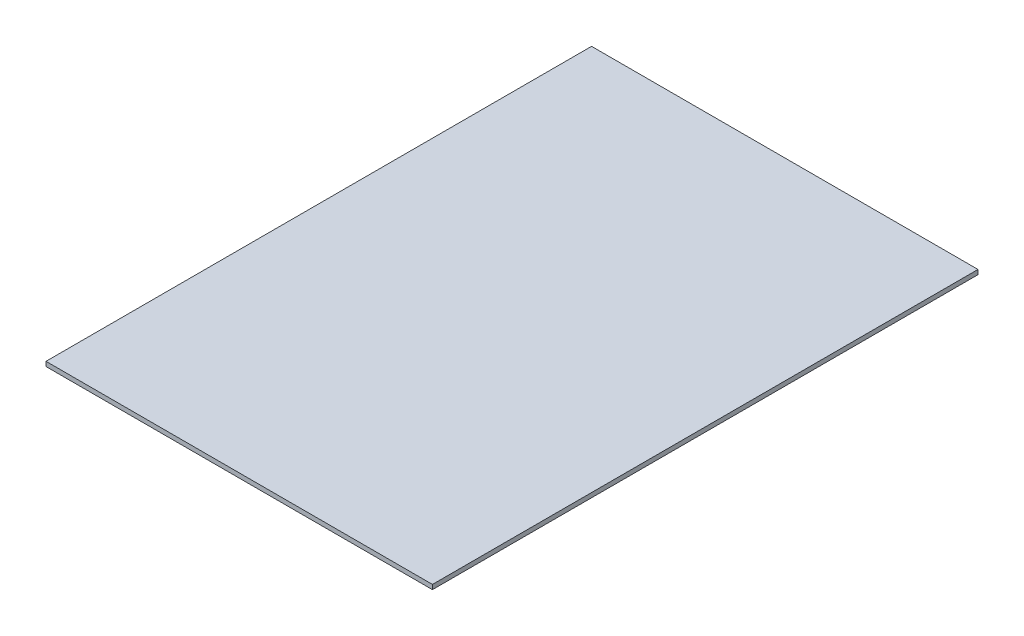
from build123d import *

# Parameters (mm, degrees)
SKETCH_1_W      = 85
SKETCH_1_H      = 120
EXTRUDE_1_DEPTH = 1


with BuildPart() as part:
    # Эскиз1 → Бобышка-Вытянуть1 (new body)
    with BuildSketch(Plane(origin=(0, 0, 0), x_dir=(1, 0, 0), z_dir=(0, 1, 0))):
        Rectangle(SKETCH_1_W, SKETCH_1_H)
    extrude(amount=EXTRUDE_1_DEPTH)


solid = part.part
